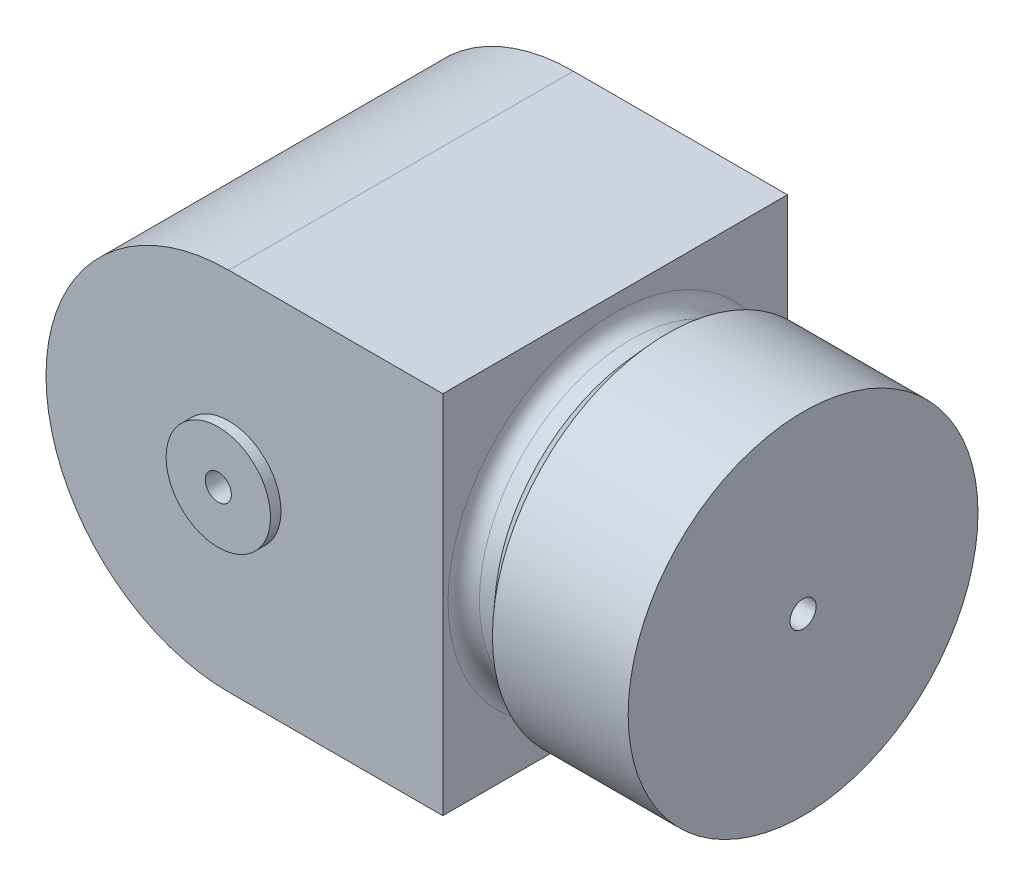
from build123d import *

# Parameters (mm, degrees)
SKETCH_1_W          = 76
SKETCH_1_H          = 70
EXTRUDE_1_DEPTH     = 66
CUT_EXTRUDE_1_DEPTH = 123.605056992
SKETCH_3_R          = 2.5
CUT_EXTRUDE_2_DEPTH = 123.605056992
SKETCH_4_R          = 29
EXTRUDE_2_DEPTH     = 6
FILLET_1_R          = 3
SKETCH_5_R          = 33.5
EXTRUDE_3_DEPTH     = 30
CHAMFER_2_SIZE      = 4
CHAMFER_2_SIZE2     = 4.442450059
SKETCH_6_R          = 2.5
CUT_EXTRUDE_3_DEPTH = 10
EXTRUDE_START       = 2
SKETCH_7_R          = 10
SKETCH_7_R_2        = 2.5
EXTRUDE_4_DEPTH     = 2
SKETCH_8_R          = 10
SKETCH_8_R_2        = 2.5
EXTRUDE_5_DEPTH     = 2


with BuildPart() as part:
    # ｽｹｯﾁ1 → 押し出し1 (new body)
    with BuildSketch(Plane.XY):
        with Locations((38, 35)):
            Rectangle(SKETCH_1_W, SKETCH_1_H)
    extrude(amount=EXTRUDE_1_DEPTH)

    # ｽｹｯﾁ2 → ｶｯﾄ - 押し出し1 (cut, through all)
    with BuildSketch(Plane.XY.offset(66)):
        with BuildLine():
            ThreePointArc((0, 35), (10.251262658, 59.748737342), (35, 70))
            Line((35, 70), (0, 70))
            Line((0, 70), (0, 35))
        make_face()
        with BuildLine():
            Line((0, 0), (35, 0))
            ThreePointArc((35, 0), (10.251262658, 10.251262658), (0, 35))
            Line((0, 35), (0, 0))
        make_face()
    extrude(amount=-CUT_EXTRUDE_1_DEPTH, mode=Mode.SUBTRACT)

    # ｽｹｯﾁ3 → ｶｯﾄ - 押し出し2 (cut, through all)
    with BuildSketch(Plane.XY.offset(66)):
        with Locations((35, 35)):
            Circle(SKETCH_3_R)
    extrude(amount=-CUT_EXTRUDE_2_DEPTH, mode=Mode.SUBTRACT)

    # ｽｹｯﾁ4 → 押し出し2 (add)
    with BuildSketch(Plane(origin=(76, 0, 0), x_dir=(0, 0, -1), z_dir=(1, 0, 0))):
        with Locations(Location((-33, 35, 0), (0, 0, 180))):
            Circle(SKETCH_4_R)
    extrude(amount=EXTRUDE_2_DEPTH)

    # ﾌｨﾚｯﾄ1
    fillet_1_edges = [part.edges().sort_by_distance(p)[0] for p in [
        (76, 35, 4),
    ]]
    fillet(fillet_1_edges, radius=FILLET_1_R)

    # ｽｹｯﾁ5 → 押し出し3 (add)
    with BuildSketch(Plane(origin=(82, 0, 0), x_dir=(0, 0, -1), z_dir=(1, 0, 0))):
        with Locations((-33, 35)):
            Circle(SKETCH_5_R)
    extrude(amount=EXTRUDE_3_DEPTH)

    # 面取り2
    chamfer_2_edges = [part.edges().sort_by_distance(p)[0] for p in [
        (82, 35, 66.5),
    ]]
    chamfer_2_side = [part.faces().sort_by_distance(p)[0] for p in [
        (97, 35, 66.5),
    ]]
    chamfer(chamfer_2_edges, length=CHAMFER_2_SIZE, length2=CHAMFER_2_SIZE2, reference=chamfer_2_side[0])

    # ｽｹｯﾁ6 → ｶｯﾄ - 押し出し3 (cut)
    with BuildSketch(Plane(origin=(112, 0, 0), x_dir=(0, 0, -1), z_dir=(1, 0, 0))):
        with Locations((-33, 35)):
            Circle(SKETCH_6_R)
    extrude(amount=-CUT_EXTRUDE_3_DEPTH, mode=Mode.SUBTRACT)

    # ｽｹｯﾁ7 → 押し出し4 (add)
    with BuildSketch(Plane.XY.offset(66).offset(EXTRUDE_START)):
        with Locations(Location((35, 35, 0), (0, 0, 180))):
            Circle(SKETCH_7_R)
        with Locations((35, 35)):
            Circle(SKETCH_7_R_2, mode=Mode.SUBTRACT)
    extrude(amount=-EXTRUDE_4_DEPTH)

    # ｽｹｯﾁ8 → 押し出し5 (add)
    with BuildSketch(Plane(origin=(0, 0, 0), x_dir=(-1, 0, 0), z_dir=(0, 0, -1))):
        with Locations((-35, 35)):
            Circle(SKETCH_8_R)
        with Locations(Location((-35, 35, 0), (0, 0, 180))):
            Circle(SKETCH_8_R_2, mode=Mode.SUBTRACT)
    extrude(amount=EXTRUDE_5_DEPTH)


solid = part.part
